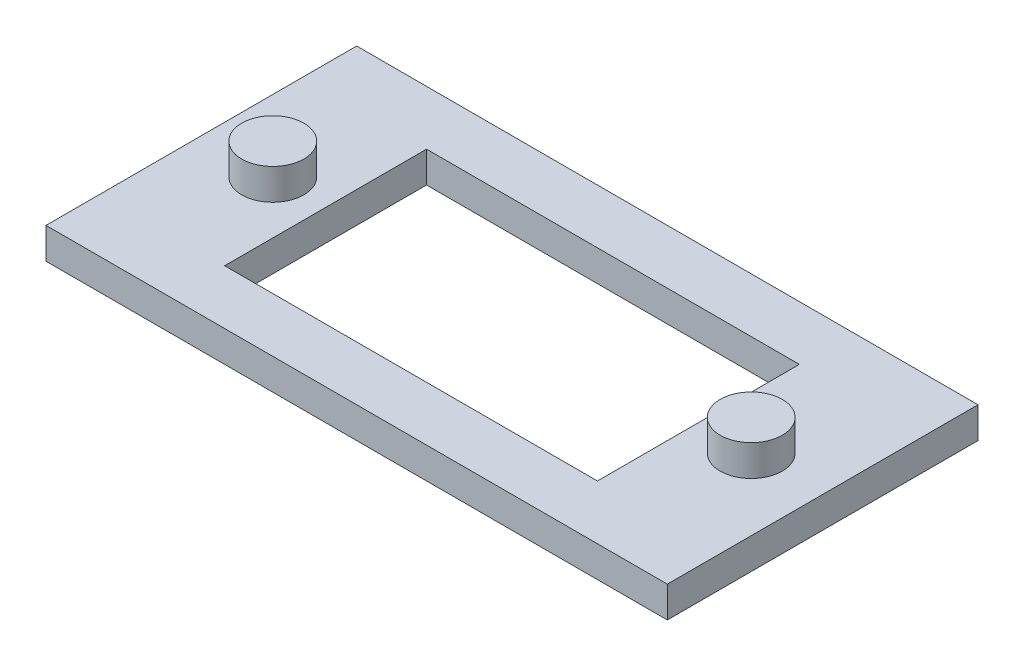
from build123d import *

# Parameters (mm, degrees)
SKETCH1_W           = 20
SKETCH1_H           = 10
BOSS_EXTRUDE1_DEPTH = 1
SKETCH2_W           = 12
SKETCH2_H           = 6.5
CUT_EXTRUDE1_DEPTH  = 4
SKETCH3_R           = 1
BOSS_EXTRUDE2_DEPTH = 1


with BuildPart() as part:
    # Sketch1 → Boss-Extrude1 (new body)
    with BuildSketch(Plane(origin=(0, 0, 0), x_dir=(1, 0, 0), z_dir=(0, 1, 0))):
        Rectangle(SKETCH1_W, SKETCH1_H)
    extrude(amount=BOSS_EXTRUDE1_DEPTH)

    # Sketch2 → Cut-Extrude1 (cut)
    with BuildSketch(Plane(origin=(0, 1, 0), x_dir=(1, 0, 0), z_dir=(0, 1, 0))):
        Rectangle(SKETCH2_W, SKETCH2_H)
    extrude(amount=-CUT_EXTRUDE1_DEPTH, mode=Mode.SUBTRACT)

    # Sketch3 → Boss-Extrude2 (add)
    with BuildSketch(Plane(origin=(0, 1, 0), x_dir=(1, 0, 0), z_dir=(0, 1, 0))):
        with Locations(Location((-7.7, 0, 0), (0, 0, 90))):
            Circle(SKETCH3_R)
        with Locations(Location((7.7, 0, 0), (0, 0, 90))):
            Circle(SKETCH3_R)
    extrude(amount=BOSS_EXTRUDE2_DEPTH)


solid = part.part
